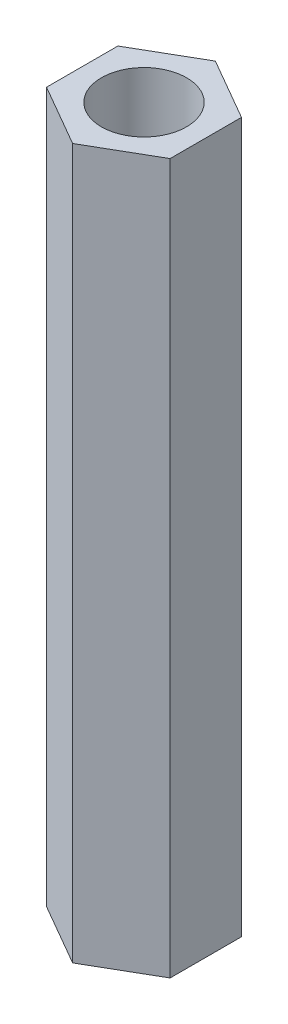
from build123d import *

# Parameters (mm, degrees)
SKETCH_1_R      = 1.5
EXTRUDE_1_DEPTH = 25


with BuildPart() as part:
    # 草图1 → 凸台-拉伸1 (new body)
    with BuildSketch(Plane(origin=(0, 0, 0), x_dir=(1, 0, 0), z_dir=(0, 1, 0))):
        Polygon((0, 2.513901358), (-2.177102439, 1.256950679), (-2.177102439, -1.256950679), (0, -2.513901358), (2.177102439, -1.256950679), (2.177102439, 1.256950679), align=None)
        with Locations(Location((0, 0, 0), (0, 0, 270))):
            Circle(SKETCH_1_R, mode=Mode.SUBTRACT)
    extrude(amount=EXTRUDE_1_DEPTH)


solid = part.part
